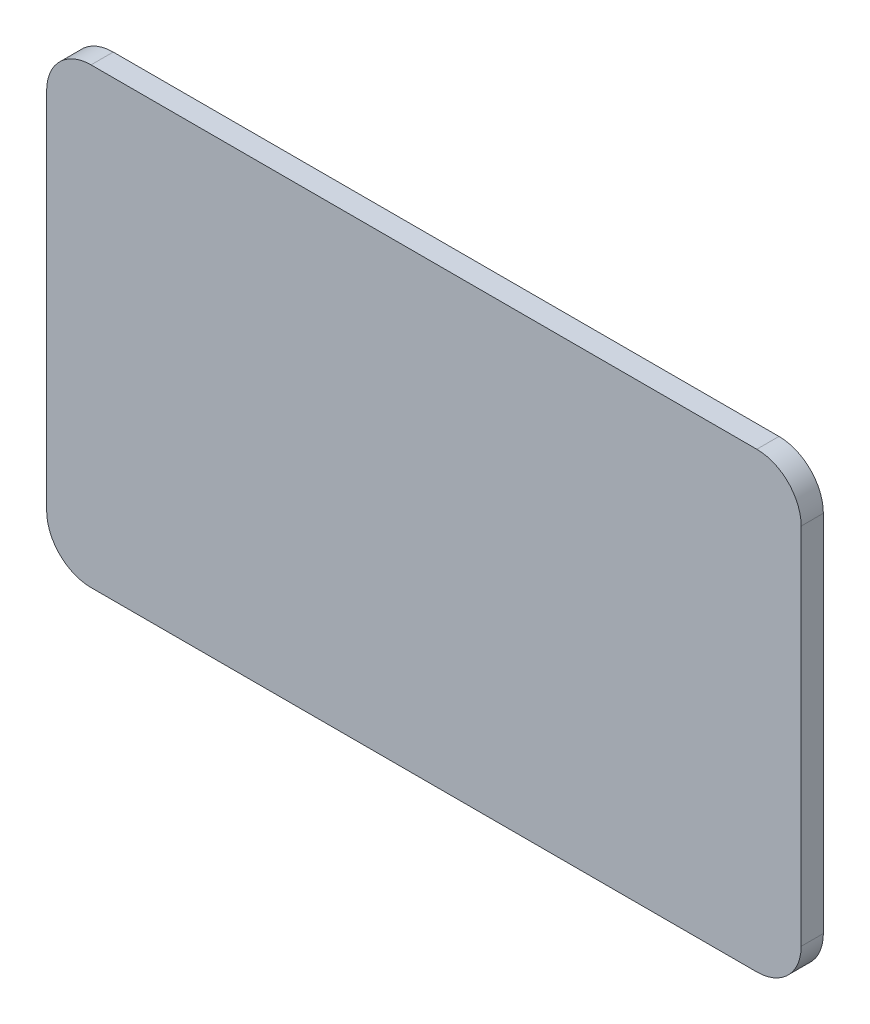
from build123d import *

# Parameters (mm, degrees)
EXTRUDE_1_DEPTH = 5


with BuildPart() as part:
    # 草图1 → 凸台-拉伸1 (new body)
    with BuildSketch(Plane.XY):
        with BuildLine():
            Line((10, 0), (160, 0))
            ThreePointArc((160, 0), (167.071067812, 2.928932188), (170, 10))
            Line((170, 10), (170, 92))
            ThreePointArc((170, 92), (167.071067812, 99.071067812), (160, 102))
            Line((160, 102), (10, 102))
            ThreePointArc((10, 102), (2.928932188, 99.071067812), (0, 92))
            Line((0, 92), (0, 10))
            ThreePointArc((0, 10), (2.928932188, 2.928932188), (10, 0))
        make_face()
    extrude(amount=EXTRUDE_1_DEPTH)


solid = part.part
